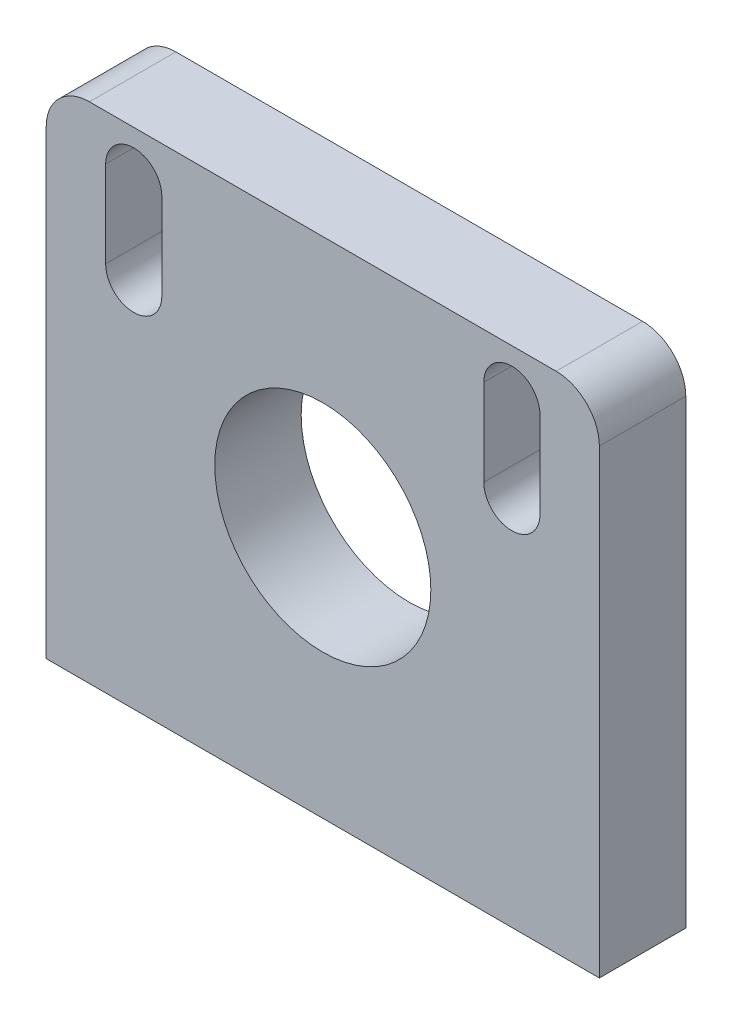
from build123d import *

# Parameters (mm, degrees)
SKETCH2_W           = 64
SKETCH2_H           = 58.3
BOSS_EXTRUDE1_DEPTH = 5
SKETCH3_R           = 2.5
CUT_EXTRUDE1_DEPTH  = 10
FILLET1_R           = 5
SKETCH4_R           = 12.5
CUT_EXTRUDE2_DEPTH  = 10


with BuildPart() as part:
    # Sketch2 → Boss-Extrude1 (new, symmetric)
    with BuildSketch(Plane.XY):
        Rectangle(SKETCH2_W, SKETCH2_H)
        with BuildLine():
            ThreePointArc((-25.125, 23.85), (-21.875, 27.1), (-18.625, 23.85))
            Line((-18.625, 23.85), (-18.625, 13.85))
            ThreePointArc((-18.625, 13.85), (-21.875, 10.6), (-25.125, 13.85))
            Line((-25.125, 13.85), (-25.125, 23.85))
        make_face(mode=Mode.SUBTRACT)
        with BuildLine():
            Line((18.625, 13.85), (18.625, 23.85))
            ThreePointArc((18.625, 23.85), (21.875, 27.1), (25.125, 23.85))
            Line((25.125, 23.85), (25.125, 13.85))
            ThreePointArc((25.125, 13.85), (21.875, 10.6), (18.625, 13.85))
        make_face(mode=Mode.SUBTRACT)
    extrude(amount=BOSS_EXTRUDE1_DEPTH, both=True)

    # Sketch3 → Cut-Extrude1 (cut)
    with BuildSketch(Plane.XZ.offset(29.15)):
        with Locations(Location((-24, 0, 0), (0, 0, 270))):
            Circle(SKETCH3_R)
        with Locations(Location((24, 0, 0), (0, 0, 90))):
            Circle(SKETCH3_R)
    extrude(amount=-CUT_EXTRUDE1_DEPTH, mode=Mode.SUBTRACT)

    # Fillet1
    fillet1_edges = [part.edges().sort_by_distance(p)[0] for p in [
        (-32, 29.15, 0),
        (32, 29.15, 0),
    ]]
    fillet(fillet1_edges, radius=FILLET1_R)

    # Sketch4 → Cut-Extrude2 (cut)
    with BuildSketch(Plane.XY.offset(5)):
        Circle(SKETCH4_R)
    extrude(amount=-CUT_EXTRUDE2_DEPTH, mode=Mode.SUBTRACT)


solid = part.part
